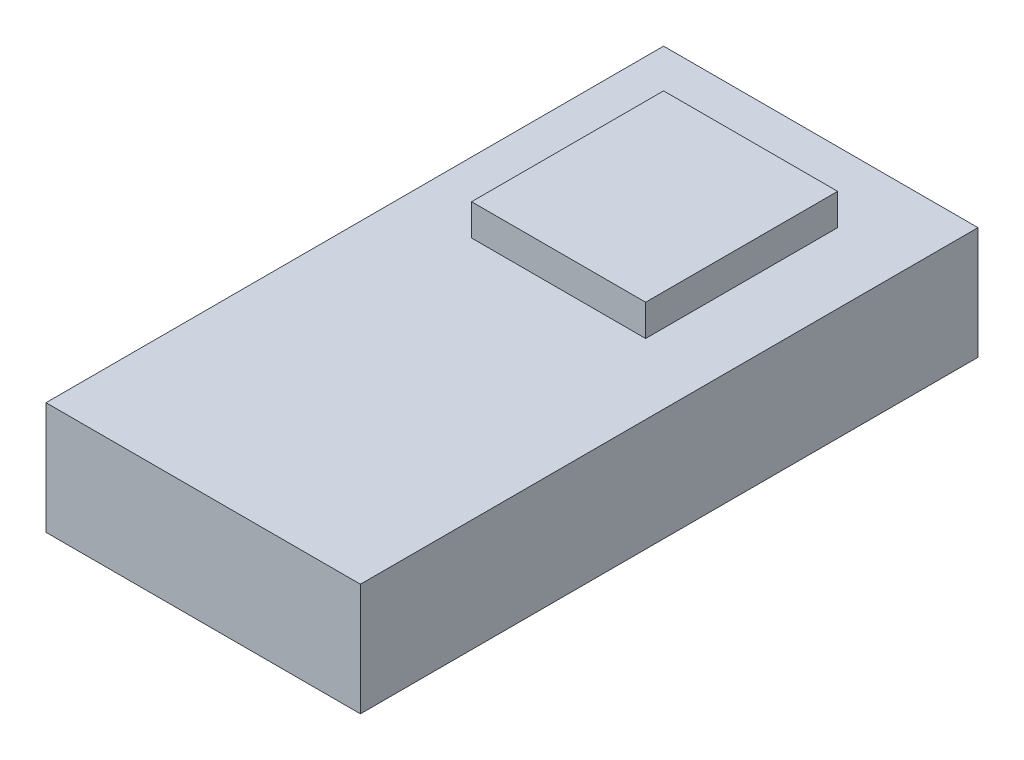
from build123d import *

# Parameters (mm, degrees)
SKETCH2_W           = 28
SKETCH2_H           = 55
BOSS_EXTRUDE1_DEPTH = 10
SKETCH3_W           = 15.5
SKETCH3_H           = 17.1
BOSS_EXTRUDE2_DEPTH = 2.8


with BuildPart() as part:
    # Sketch2 → Boss-Extrude1 (new body)
    with BuildSketch(Plane(origin=(0, 0, 0), x_dir=(1, 0, 0), z_dir=(0, 1, 0))):
        with Locations((14, 27.5)):
            Rectangle(SKETCH2_W, SKETCH2_H)
    extrude(amount=BOSS_EXTRUDE1_DEPTH)

    # Sketch3 → Boss-Extrude2 (add)
    with BuildSketch(Plane(origin=(0, 10, 0), x_dir=(1, 0, 0), z_dir=(0, 1, 0))):
        with Locations((14, 40.2)):
            Rectangle(SKETCH3_W, SKETCH3_H)
    extrude(amount=BOSS_EXTRUDE2_DEPTH)


solid = part.part
